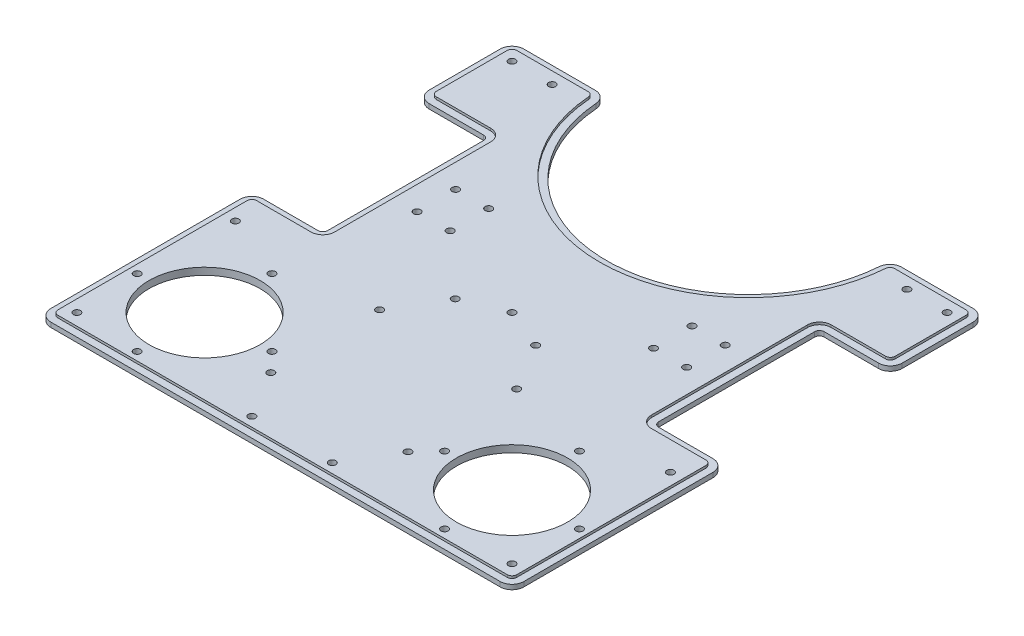
from build123d import *

# Parameters (mm, degrees)
SKETCH3_W           = 200
SKETCH3_H           = 200
BOSS_EXTRUDE1_DEPTH = 3
SKETCH4_R           = 1.5
SKETCH4_R_2         = 23.5
SKETCH4_R_3         = 60
SKETCH4_W           = 30
SKETCH4_H           = 70
CUT_EXTRUDE1_DEPTH  = 5
FILLET1_R           = 5
FILLET2_R           = 2
CUT_EXTRUDE2_START  = -1
CUT_EXTRUDE2_DEPTH  = 1


with BuildPart() as part:
    # Sketch3 → Boss-Extrude1 (new body)
    with BuildSketch(Plane(origin=(0, 0, 0), x_dir=(1, 0, 0), z_dir=(0, 1, 0))):
        Rectangle(SKETCH3_W, SKETCH3_H)
    extrude(amount=BOSS_EXTRUDE1_DEPTH)

    # Sketch4 → Cut-Extrude1 (cut)
    with BuildSketch(Plane(origin=(0, 3, 0), x_dir=(1, 0, 0), z_dir=(0, 1, 0))):
        with Locations(Location((92, 92, 0), (0, 0, 270))):
            Circle(SKETCH4_R)
        with Locations(Location((92, -92, 0), (0, 0, 270))):
            Circle(SKETCH4_R)
        with Locations(Location((-92, -92, 0), (0, 0, 270))):
            Circle(SKETCH4_R)
        with Locations(Location((-92, 92, 0), (0, 0, 270))):
            Circle(SKETCH4_R)
        with Locations(Location((92, -25, 0), (0, 0, 270))):
            Circle(SKETCH4_R)
        with Locations(Location((93.5, -65, 0), (0, 0, 270))):
            Circle(SKETCH4_R)
        with Locations(Location((17, -93, 0), (0, 0, 270))):
            Circle(SKETCH4_R)
        with Locations(Location((29, -73, 0), (0, 0, 270))):
            Circle(SKETCH4_R)
        with Locations(Location((75, 92, 0), (0, 0, 270))):
            Circle(SKETCH4_R)
        with Locations(Location((29, -27, 0), (0, 0, 270))):
            Circle(SKETCH4_R)
        with Locations(Location((17, -7, 0), (0, 0, 270))):
            Circle(SKETCH4_R)
        with Locations(Location((-92, -25, 0), (0, 0, 270))):
            Circle(SKETCH4_R)
        with Locations(Location((-17, -93, 0), (0, 0, 270))):
            Circle(SKETCH4_R)
        with Locations(Location((-29, -73, 0), (0, 0, 270))):
            Circle(SKETCH4_R)
        with Locations(Location((-29, -27, 0), (0, 0, 270))):
            Circle(SKETCH4_R)
        with Locations(Location((-17, -7, 0), (0, 0, 270))):
            Circle(SKETCH4_R)
        with Locations(Location((65, -65, 0), (0, 0, 270))):
            Circle(SKETCH4_R_2)
        with Locations(Location((65, -93.5, 0), (0, 0, 270))):
            Circle(SKETCH4_R)
        with Locations(Location((36.5, -65, 0), (0, 0, 270))):
            Circle(SKETCH4_R)
        with Locations(Location((65, -36.5, 0), (0, 0, 270))):
            Circle(SKETCH4_R)
        with Locations(Location((57, 16.85, 0), (0, 0, 270))):
            Circle(SKETCH4_R)
        with Locations(Location((57, 33.15, 0), (0, 0, 270))):
            Circle(SKETCH4_R)
        with Locations(Location((43, 16.85, 0), (0, 0, 270))):
            Circle(SKETCH4_R)
        with Locations(Location((43, 33.15, 0), (0, 0, 270))):
            Circle(SKETCH4_R)
        with Locations((0, 100)):
            Circle(SKETCH4_R_3)
        with Locations(Location((-75, 92, 0), (0, 0, 270))):
            Circle(SKETCH4_R)
        with Locations(Location((0, 0, 0), (0, 0, 270))):
            Circle(SKETCH4_R)
        with Locations((85, 25)):
            Rectangle(SKETCH4_W, SKETCH4_H)
    cut_extrude1 = extrude(amount=-CUT_EXTRUDE1_DEPTH, mode=Mode.SUBTRACT)

    # Mirror1: Cut-Extrude1 across plane
    add(cut_extrude1.mirror(Plane.ZY), mode=Mode.SUBTRACT)

    # Fillet1
    fillet1_edges = [part.edges().sort_by_distance(p)[0] for p in [
        (-100, 1.5, 10),
        (-100, 1.5, -60),
        (-100, 1.5, -100),
        (100, 1.5, -100),
        (100, 1.5, 100),
        (-100, 1.5, 100),
        (60, 1.5, -100),
        (-60, 1.5, -100),
        (100, 1.5, -60),
        (100, 1.5, 10),
    ]]
    fillet(fillet1_edges, radius=FILLET1_R)

    # Fillet2
    fillet2_edges = [part.edges().sort_by_distance(p)[0] for p in [
        (-70, 1.5, -60),
        (-70, 1.5, 10),
        (70, 1.5, 10),
        (70, 1.5, -60),
    ]]
    fillet(fillet2_edges, radius=FILLET2_R)

    # Sketch5 → Cut-Extrude2 (cut)
    with BuildSketch(Plane(origin=(0, 3, 0), x_dir=(1, 0, 0), z_dir=(0, 1, 0)).offset(CUT_EXTRUDE2_START)):
        with BuildLine():
            Line((-95, -100), (95, -100))
            ThreePointArc((95, -100), (98.535533906, -98.535533906), (100, -95))
            Line((100, -95), (100, -15))
            ThreePointArc((100, -15), (98.535533906, -11.464466094), (95, -10))
            Line((95, -10), (72, -10))
            ThreePointArc((72, -10), (70.585786438, -9.414213562), (70, -8))
            Line((70, -8), (70, 58))
            ThreePointArc((70, 58), (70.585786438, 59.414213562), (72, 60))
            Line((72, 60), (95, 60))
            ThreePointArc((95, 60), (98.535533906, 61.464466094), (100, 65))
            Line((100, 65), (100, 95))
            ThreePointArc((100, 95), (98.535533906, 98.535533906), (95, 100))
            Line((95, 100), (64.807406984, 100))
            ThreePointArc((64.807406984, 100), (61.410575882, 98.668996929), (59.822221831, 95.384615385))
            ThreePointArc((59.822221831, 95.384615385), (0, 40), (-59.822221831, 95.384615385))
            ThreePointArc((-59.822221831, 95.384615385), (-61.410575882, 98.668996929), (-64.807406984, 100))
            Line((-64.807406984, 100), (-95, 100))
            ThreePointArc((-95, 100), (-98.535533906, 98.535533906), (-100, 95))
            Line((-100, 95), (-100, 65))
            ThreePointArc((-100, 65), (-98.535533906, 61.464466094), (-95, 60))
            Line((-95, 60), (-72, 60))
            ThreePointArc((-72, 60), (-70.585786438, 59.414213562), (-70, 58))
            Line((-70, 58), (-70, -8))
            ThreePointArc((-70, -8), (-70.585786438, -9.414213562), (-72, -10))
            Line((-72, -10), (-95, -10))
            ThreePointArc((-95, -10), (-98.535533906, -11.464466094), (-100, -15))
            Line((-100, -15), (-100, -95))
            ThreePointArc((-100, -95), (-98.535533906, -98.535533906), (-95, -100))
        make_face()
        with BuildLine():
            Line((-97, 95), (-97, 65))
            ThreePointArc((-97, 65), (-96.414213562, 63.585786438), (-95, 63))
            Line((-95, 63), (-72, 63))
            ThreePointArc((-72, 63), (-68.464466094, 61.535533906), (-67, 58))
            Line((-67, 58), (-67, -8))
            ThreePointArc((-67, -8), (-68.464466094, -11.535533906), (-72, -13))
            Line((-72, -13), (-95, -13))
            ThreePointArc((-95, -13), (-96.414213562, -13.585786438), (-97, -15))
            Line((-97, -15), (-97, -95))
            ThreePointArc((-97, -95), (-96.414213562, -96.414213562), (-95, -97))
            Line((-95, -97), (95, -97))
            ThreePointArc((95, -97), (96.414213562, -96.414213562), (97, -95))
            Line((97, -95), (97, -15))
            ThreePointArc((97, -15), (96.414213562, -13.585786438), (95, -13))
            Line((95, -13), (72, -13))
            ThreePointArc((72, -13), (68.464466094, -11.535533906), (67, -8))
            Line((67, -8), (67, 58))
            ThreePointArc((67, 58), (68.464466094, 61.535533906), (72, 63))
            Line((72, 63), (95, 63))
            ThreePointArc((95, 63), (96.414213562, 63.585786438), (97, 65))
            Line((97, 65), (97, 95))
            ThreePointArc((97, 95), (96.414213562, 96.414213562), (95, 97))
            Line((95, 97), (64.807406984, 97))
            ThreePointArc((64.807406984, 97), (63.448674543, 96.467598771), (62.813332923, 95.153846154))
            ThreePointArc((62.813332923, 95.153846154), (0, 37), (-62.813332923, 95.153846154))
            ThreePointArc((-62.813332923, 95.153846154), (-63.448674543, 96.467598771), (-64.807406984, 97))
            Line((-64.807406984, 97), (-95, 97))
            ThreePointArc((-95, 97), (-96.414213562, 96.414213562), (-97, 95))
        make_face(mode=Mode.SUBTRACT)
    extrude(amount=CUT_EXTRUDE2_DEPTH, mode=Mode.SUBTRACT)


solid = part.part
